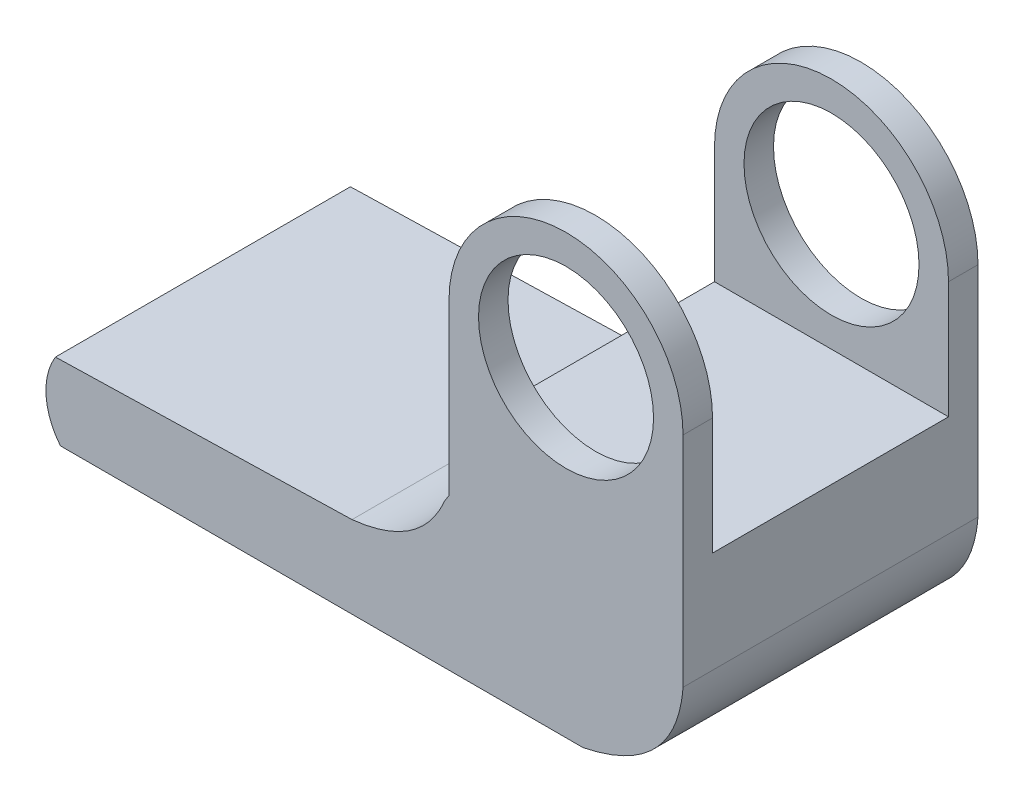
from build123d import *

# Parameters (mm, degrees)
SKETCH1_R           = 8.9
BOSS_EXTRUDE1_DEPTH = 30
SKETCH2_W           = 24
SKETCH2_H           = 23.8
CUT_EXTRUDE1_DEPTH  = 23.8


with BuildPart() as part:
    # Sketch1 → Boss-Extrude1 (new body)
    with BuildSketch(Plane.XY):
        with BuildLine():
            ThreePointArc((11.9, 0), (0, 11.9), (-11.9, 0))
            Line((-11.9, 0), (-11.9, -16.75270202))
            Line((-11.9, -16.75270202), (-11.9, -17.254561811))
            Line((-11.9, -17.254561811), (-12.301407367, -17.836587713))
            add(Edge.make_bspline(
                [(-21.764559413, -24.28445135), (-14.705345203, -23.52602921), (-12.301407367, -17.836587713)],
                knots=[0, 0, 0, 0.916072404, 0.916072404, 0.916072404], degree=2))
            Line((-21.764559413, -24.28445135), (-51.930587301, -25.04963318))
            ThreePointArc((-51.930587301, -25.04963318), (-52.886196001, -28.917406192), (-51.420694634, -32.62215474))
            Line((-51.420694634, -32.62215474), (1.732240064, -32.62215474))
            add(Edge.make_bspline(
                [(1.732240064, -32.62215474), (11.248165951, -30.665230595), (11.9, -22.221272353)],
                knots=[0, 0, 0, 1, 1, 1], degree=2))
            Line((11.9, -22.221272353), (11.9, 0))
        make_face()
        Circle(SKETCH1_R, mode=Mode.SUBTRACT)
    extrude(amount=BOSS_EXTRUDE1_DEPTH)

    # Sketch2 → Cut-Extrude1 (cut)
    with BuildSketch(Plane.ZY.offset(11.9)):
        with Locations((15, 0)):
            Rectangle(SKETCH2_W, SKETCH2_H)
    extrude(amount=-CUT_EXTRUDE1_DEPTH, mode=Mode.SUBTRACT)


solid = part.part
